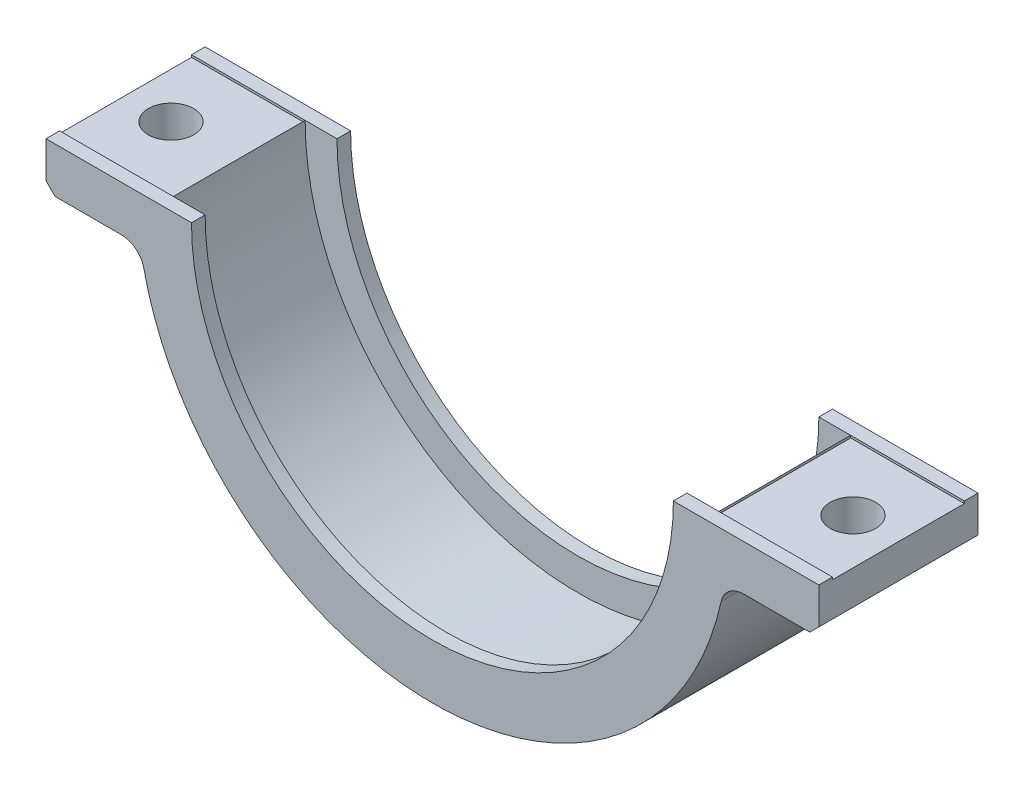
from build123d import *

# Parameters (mm, degrees)
DODANIE_WYCI_GNI_CIE1_DEPTH = 14.5
DODANIE_WYCI_GNI_CIE2_START = 3
DODANIE_WYCI_GNI_CIE2_DEPTH = 3
DODANIE_WYCI_GNI_CIE3_DEPTH = 3
OTW_R_10_0_10_1_D           = 10
WYTNIJ_WYCI_GNI_CIE1_START  = -0.5
SZKIC7_W                    = 25
SZKIC7_H                    = 29
SZKIC7_R                    = 5
WYTNIJ_WYCI_GNI_CIE1_DEPTH  = 0.5


with BuildPart() as part:
    # Szkic1 → Dodanie-wyciągnięcie1 (new, symmetric)
    with BuildSketch(Plane.XY):
        with BuildLine():
            Line((-83, -10), (-68.373971656, -10))
            ThreePointArc((-68.373971656, -10), (-65.240055803, -11.104031388), (-63.490116538, -13.928571429))
            ThreePointArc((-63.490116538, -13.928571429), (0, -65), (63.490116538, -13.928571429))
            ThreePointArc((63.490116538, -13.928571429), (65.240055803, -11.104031388), (68.373971656, -10))
            Line((68.373971656, -10), (83, -10))
            Line((83, -10), (85, -8))
            Line((85, -8), (85, 0))
            Line((85, 0), (65, 0))
            Line((65, 0), (60, 0))
            ThreePointArc((60, 0), (0, -60), (-60, 0))
            Line((-60, 0), (-65, 0))
            Line((-65, 0), (-85, 0))
            Line((-85, 0), (-85, -8))
            Line((-85, -8), (-83, -10))
        make_face()
    extrude(amount=DODANIE_WYCI_GNI_CIE1_DEPTH, both=True)

    # Szkic2 → Dodanie-wyciągnięcie2 (add)
    with BuildSketch(Plane.XY.offset(14.5).offset(DODANIE_WYCI_GNI_CIE2_START)):
        with BuildLine():
            Line((-65, 0), (-60, 0))
            Line((-60, 0), (-53, 0))
            ThreePointArc((-53, 0), (0, -53), (53, 0))
            Line((53, 0), (60, 0))
            Line((60, 0), (65, 0))
            Line((65, 0), (85, 0))
            Line((85, 0), (85, -8))
            Line((85, -8), (83, -10))
            Line((83, -10), (68.373971656, -10))
            ThreePointArc((68.373971656, -10), (65.240055803, -11.104031388), (63.490116538, -13.928571429))
            ThreePointArc((63.490116538, -13.928571429), (0, -65), (-63.490116538, -13.928571429))
            ThreePointArc((-63.490116538, -13.928571429), (-65.240055803, -11.104031388), (-68.373971656, -10))
            Line((-68.373971656, -10), (-83, -10))
            Line((-83, -10), (-85, -8))
            Line((-85, -8), (-85, 0))
            Line((-85, 0), (-65, 0))
        make_face()
    extrude(amount=-DODANIE_WYCI_GNI_CIE2_DEPTH)

    # Szkic3 → Dodanie-wyciągnięcie3 (add)
    with BuildSketch(Plane(origin=(0, 0, -14.5), x_dir=(-1, 0, 0), z_dir=(0, 0, -1))):
        with BuildLine():
            Line((-65, 0), (-60, 0))
            Line((-60, 0), (-53, 0))
            ThreePointArc((-53, 0), (0, -53), (53, 0))
            Line((53, 0), (60, 0))
            Line((60, 0), (65, 0))
            Line((65, 0), (85, 0))
            Line((85, 0), (85, -8))
            Line((85, -8), (83, -10))
            Line((83, -10), (68.373971656, -10))
            ThreePointArc((68.373971656, -10), (65.240055803, -11.104031388), (63.490116538, -13.928571429))
            ThreePointArc((63.490116538, -13.928571429), (0, -65), (-63.490116538, -13.928571429))
            ThreePointArc((-63.490116538, -13.928571429), (-65.240055803, -11.104031388), (-68.373971656, -10))
            Line((-68.373971656, -10), (-83, -10))
            Line((-83, -10), (-85, -8))
            Line((-85, -8), (-85, 0))
            Line((-85, 0), (-65, 0))
        make_face()
    extrude(amount=DODANIE_WYCI_GNI_CIE3_DEPTH)

    # Otwór Ø10.0 (10)1 (through all)
    with Locations(Plane(origin=(0, 0, 0), x_dir=(1, 0, 0), z_dir=(0, 1, 0))):
        with Locations((75, 0), (-75, 0)):
            Hole(OTW_R_10_0_10_1_D / 2)

    # Szkic7 → Wytnij-wyciągnięcie1 (cut)
    # profile 1 of 2: a face of its own
    with BuildSketch(Plane(origin=(0, 0, 0), x_dir=(1, 0, 0), z_dir=(0, 1, 0)).offset(WYTNIJ_WYCI_GNI_CIE1_START)):
        with Locations((-72.5, 0)):
            Rectangle(SZKIC7_W, SZKIC7_H)
        with Locations(Location((-75, 0, 0), (0, 0, 270))):
            Circle(SZKIC7_R, mode=Mode.SUBTRACT)
    # profile 2 of 2: a face of its own
    with BuildSketch(Plane(origin=(0, 0, 0), x_dir=(1, 0, 0), z_dir=(0, 1, 0)).offset(WYTNIJ_WYCI_GNI_CIE1_START)):
        with Locations((72.5, 0)):
            Rectangle(SZKIC7_W, SZKIC7_H)
    extrude(amount=WYTNIJ_WYCI_GNI_CIE1_DEPTH, mode=Mode.SUBTRACT)


solid = part.part
